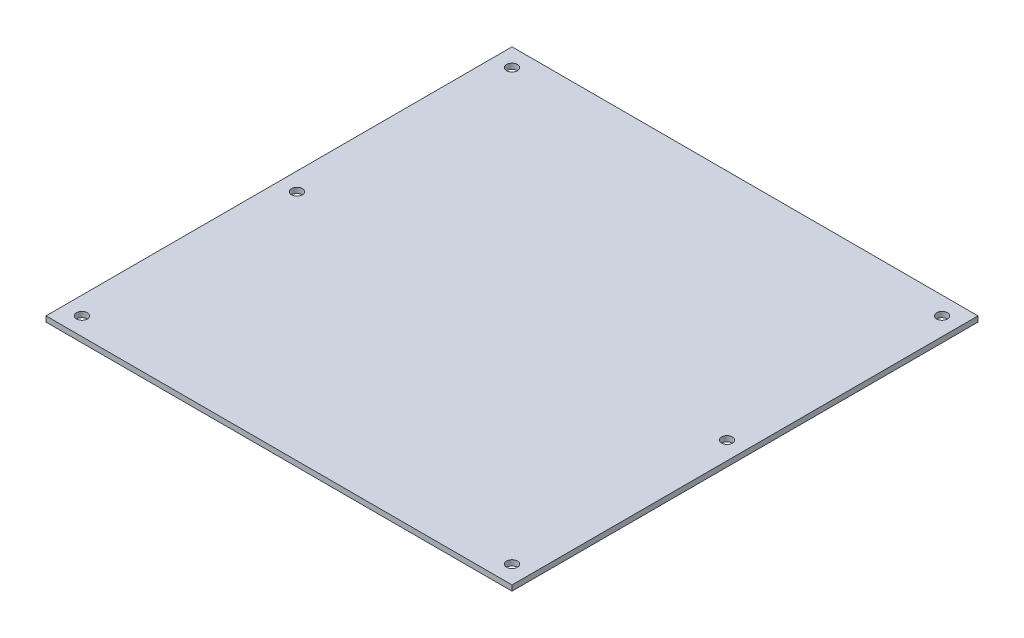
from build123d import *

# Parameters (mm, degrees)
SKETCH1_W           = 342.9
SKETCH1_H           = 342.9
BOSS_EXTRUDE1_DEPTH = 4
SKETCH2_R           = 4
CUT_EXTRUDE1_DEPTH  = 243.499907216


with BuildPart() as part:
    # Sketch1 → Boss-Extrude1 (new body)
    with BuildSketch(Plane(origin=(0, 0, 0), x_dir=(1, 0, 0), z_dir=(0, 1, 0))):
        Rectangle(SKETCH1_W, SKETCH1_H)
    extrude(amount=BOSS_EXTRUDE1_DEPTH)

    # Sketch2 → Cut-Extrude1 (cut, through all)
    with BuildSketch(Plane(origin=(0, 4, 0), x_dir=(1, 0, 0), z_dir=(0, 1, 0))):
        with Locations(Location((-158.225, 158.225, 0), (0, 0, 270))):
            Circle(SKETCH2_R)
        with Locations(Location((-158.225, 0, 0), (0, 0, 270))):
            Circle(SKETCH2_R)
        with Locations(Location((-158.225, -158.225, 0), (0, 0, 270))):
            Circle(SKETCH2_R)
        with Locations(Location((158.225, 158.225, 0), (0, 0, 270))):
            Circle(SKETCH2_R)
        with Locations(Location((158.225, 0, 0), (0, 0, 270))):
            Circle(SKETCH2_R)
        with Locations(Location((158.225, -158.225, 0), (0, 0, 270))):
            Circle(SKETCH2_R)
    extrude(amount=-CUT_EXTRUDE1_DEPTH, mode=Mode.SUBTRACT)


solid = part.part
